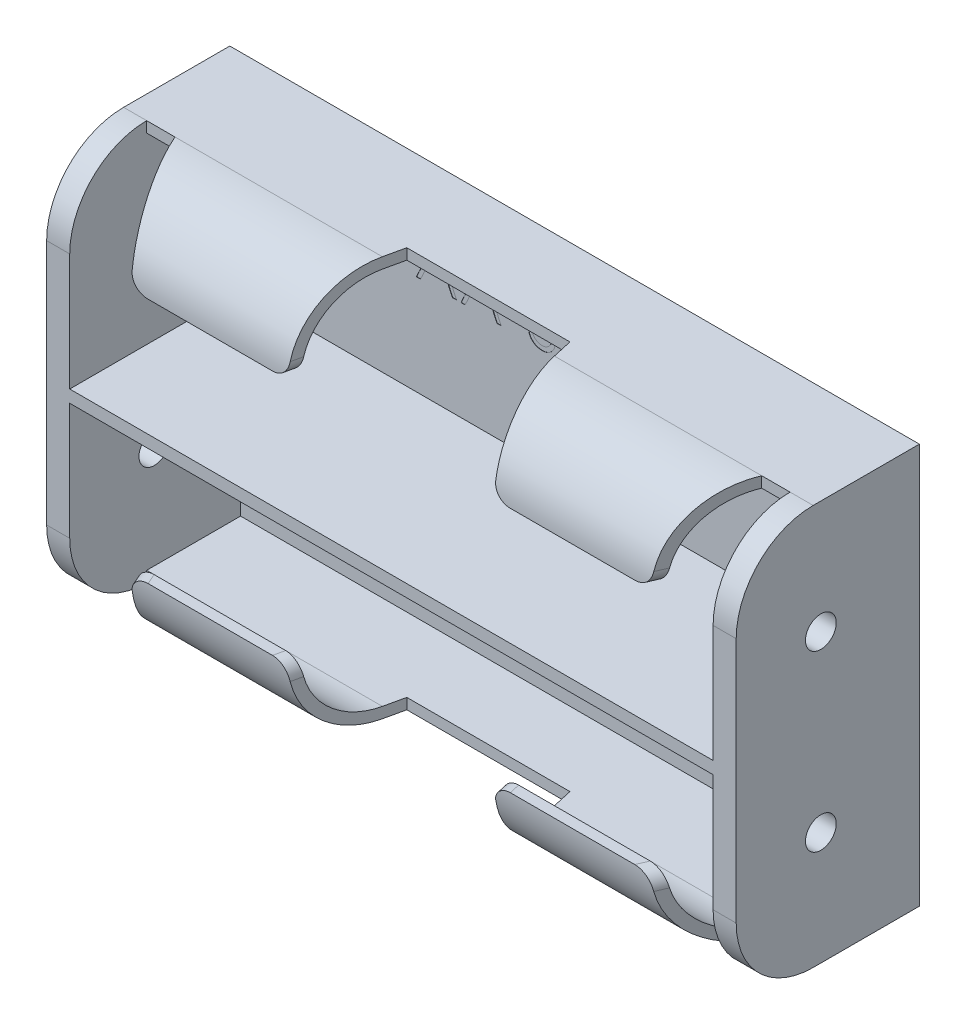
from build123d import *

# Parameters (mm, degrees)
SKETCH1_W            = 56.896
SKETCH1_H            = 33.02
EXTRUDE1_DEPTH       = 15.113
FILLET1_R            = 6.35
CUT_EXTRUDE1_DEPTH   = 26.543
CUT_EXTRUDE2_DEPTH   = 7.112
FILLET2_R            = 1.27
SKETCH4_R            = 1.27
CUT_EXTRUDE3_DEPTH   = 49.403
FILLET2_OF_MIRROR1_R = 1.27
SKETCH5_W            = 1.346153846
SKETCH5_H            = 0.358974359
CUT_EXTRUDE4_DEPTH   = 0.0254


with BuildPart() as part:
    # Sketch1 → Extrude1 (new body)
    with BuildSketch(Plane.XY):
        Rectangle(SKETCH1_W, SKETCH1_H)
    extrude(amount=EXTRUDE1_DEPTH)

    # Fillet1
    fillet1_edges = [part.edges().sort_by_distance(p)[0] for p in [
        (0, 16.51, 15.113),
        (0, -16.51, 15.113),
    ]]
    fillet(fillet1_edges, radius=FILLET1_R)

    # Sketch2 → Cut-Extrude1 (cut, symmetric)
    with BuildSketch(Plane(origin=(0, 0, 0), x_dir=(0, 0, -1), z_dir=(1, 0, 0))):
        with BuildLine():
            Line((-1.016, 15.621), (-1.016, 0.508))
            Line((-1.016, 0.508), (-15.113, 0.508))
            Line((-15.113, 0.508), (-15.113, 10.16))
            Line((-15.113, 10.16), (-14.224, 10.16))
            ThreePointArc((-14.224, 10.16), (-12.624510132, 14.021510132), (-8.763, 15.621))
            Line((-8.763, 15.621), (-1.016, 15.621))
        make_face()
    cut_extrude1 = extrude(amount=CUT_EXTRUDE1_DEPTH, both=True, mode=Mode.SUBTRACT)

    # Sketch3 → Cut-Extrude2 (cut)
    with BuildSketch(Plane(origin=(0, 16.51, 0), x_dir=(-1, 0, 0), z_dir=(0, 1, 0))):
        Polygon((-8.509, 15.113), (8.509, 15.113), (6.731, 7.112), (-6.731, 7.112), align=None)
        Polygon((-26.543, 8.763), (-26.543, 15.113), (-21.463, 15.113), (-24.2062, 8.763), align=None)
        Polygon((26.543, 8.763), (24.2062, 8.763), (21.463, 15.113), (26.543, 15.113), align=None)
    cut_extrude2 = extrude(amount=-CUT_EXTRUDE2_DEPTH, mode=Mode.SUBTRACT)

    # Fillet2
    fillet2_edges = [part.edges().sort_by_distance(p)[0] for p in [
        (-21.655024, 10.16, 14.6685),
        (-8.410222222, 10.16, 14.6685),
        (21.655024, 10.16, 14.6685),
        (8.410222222, 10.16, 14.6685),
    ]]
    fillet(fillet2_edges, radius=FILLET2_R)

    # Sketch4 → Cut-Extrude3 (cut, symmetric)
    with BuildSketch(Plane(origin=(0, 0, 0), x_dir=(0, 0, -1), z_dir=(1, 0, 0))):
        with Locations((-8.128, 7.1755)):
            Circle(SKETCH4_R)
    cut_extrude3 = extrude(amount=CUT_EXTRUDE3_DEPTH, both=True, mode=Mode.SUBTRACT)

    # Mirror1: Cut-Extrude1, Cut-Extrude2, Cut-Extrude3 across plane
    add(cut_extrude1.mirror(Plane.ZX), mode=Mode.SUBTRACT)
    add(cut_extrude2.mirror(Plane.ZX), mode=Mode.SUBTRACT)
    add(cut_extrude3.mirror(Plane.ZX), mode=Mode.SUBTRACT)

    # Fillet2 of Mirror1
    fillet2_of_mirror1_edges = [part.edges().sort_by_distance(p)[0] for p in [
        (-21.655024, -10.16, 14.6685),
        (-8.410222222, -10.16, 14.6685),
        (21.655024, -10.16, 14.6685),
        (8.410222222, -10.16, 14.6685),
    ]]
    fillet(fillet2_of_mirror1_edges, radius=FILLET2_OF_MIRROR1_R)

    # Sketch5 → Cut-Extrude4 (cut)
    # profile 1 of 18: a face of its own
    with BuildSketch(Plane.XY.offset(1.016)):
        with BuildLine():
            Line((-19.042761869, 12.232997554), (-18.342341196, 12.232997554))
            add(Edge.make_bspline(
                [(-18.342341196, 12.232997554), (-18.295600068, 12.232841968), (-18.205851923, 12.232543225), (-18.077278653, 12.230877462), (-17.960451556, 12.226103107), (-17.855431717, 12.221994523), (-17.762221062, 12.214502582), (-17.680533771, 12.207341935), (-17.610746073, 12.197968274), (-17.568500222, 12.189262851), (-17.549372446, 12.185321272)],
                knots=[0, 0, 0, 0, 1.410062039, 2.707475311, 3.878576406, 4.937260626, 5.877586885, 6.699081471, 7.410979367, 8, 8, 8, 8], degree=3))
            add(Edge.make_bspline(
                [(-17.549372446, 12.185321272), (-17.523765822, 12.178994506), (-17.473098833, 12.166475943), (-17.400148766, 12.140016342), (-17.330634443, 12.109396717), (-17.264844618, 12.073432997), (-17.203108827, 12.031858217), (-17.144790516, 11.985390095), (-17.089625053, 11.934282889), (-17.039843423, 11.877248047), (-16.992904371, 11.817411538), (-16.953315744, 11.752707781), (-16.919189265, 11.685046253), (-16.892018748, 11.613738836), (-16.870140774, 11.539477064), (-16.854714535, 11.461588267), (-16.845463347, 11.380427292), (-16.844521492, 11.325069383), (-16.84404392, 11.296999958)],
                knots=[0, 0, 0, 0, 1.027469482, 2.033020251, 3.019912614, 3.986113645, 4.951240523, 5.91722682, 6.890402269, 7.87763091, 8.8651537, 9.85103654, 10.82876324, 11.815024772, 12.821070561, 13.842952187, 14.906261191, 16, 16, 16, 16], degree=3))
            add(Edge.make_bspline(
                [(-16.84404392, 11.296999958), (-16.845512919, 11.250364853), (-16.848379314, 11.159367685), (-16.875104418, 11.027306804), (-16.918880938, 10.904117489), (-16.979204227, 10.789954851), (-17.056023703, 10.687044206), (-17.148348494, 10.59665375), (-17.256230105, 10.521013838), (-17.356659421, 10.468561033), (-17.445373621, 10.434968124), (-17.518406934, 10.411331766), (-17.598073911, 10.3930698), (-17.683611246, 10.376709669), (-17.775374901, 10.364357974), (-17.873144941, 10.35531138), (-17.976991092, 10.349657331), (-18.048330161, 10.348815326), (-18.085029497, 10.348382169)],
                knots=[0, 0, 0, 0, 1.260483769, 2.459530307, 3.627416485, 4.787058657, 5.939039949, 7.08810263, 8.267026773, 9.491475466, 10.141966685, 10.831826277, 11.566392101, 12.351337768, 13.187381173, 14.07005841, 15.007169909, 16, 16, 16, 16], degree=3))
            Line((-18.085029497, 10.348382169), (-16.799172126, 8.732997554))
            Line((-16.799172126, 8.732997554), (-17.1875936, 8.732997554))
            Line((-17.1875936, 8.732997554), (-18.473450972, 10.348382169))
            Line((-18.473450972, 10.348382169), (-18.728659305, 10.348382169))
            Line((-18.728659305, 10.348382169), (-18.728659305, 8.732997554))
            Line((-18.728659305, 8.732997554), (-19.042761869, 8.732997554))
            Line((-19.042761869, 8.732997554), (-19.042761869, 12.232997554))
        make_face()
        with BuildLine():
            Line((-18.728659305, 11.874023195), (-18.728659305, 10.707356528))
            Line((-18.728659305, 10.707356528), (-18.087833985, 10.702448675))
            add(Edge.make_bspline(
                [(-18.087833985, 10.702448675), (-18.057913946, 10.702435439), (-17.999920389, 10.702409782), (-17.916019724, 10.706403559), (-17.837899612, 10.710946877), (-17.76585886, 10.717896222), (-17.699865285, 10.726852294), (-17.639951871, 10.738055278), (-17.586020819, 10.751107341), (-17.523122281, 10.771308967), (-17.45288575, 10.803314985), (-17.37655429, 10.849880484), (-17.311551952, 10.908449603), (-17.25663409, 10.975423059), (-17.212504658, 11.049059308), (-17.181392604, 11.128475677), (-17.161650162, 11.211667275), (-17.159321616, 11.268845383), (-17.158146485, 11.297701079)],
                knots=[0, 0, 0, 0, 1.146690395, 2.22261258, 3.21895312, 4.145990853, 4.996080663, 5.770904154, 6.481378293, 7.121626537, 8.300444488, 9.431385265, 10.535395872, 11.636531494, 12.74115979, 13.810798291, 14.895190096, 16, 16, 16, 16], degree=3))
            add(Edge.make_bspline(
                [(-17.158146485, 11.297701079), (-17.159348606, 11.325847653), (-17.161730771, 11.381623892), (-17.18117954, 11.463279802), (-17.214068921, 11.540346752), (-17.258391159, 11.612511237), (-17.312390314, 11.678016973), (-17.375708126, 11.734064126), (-17.446613322, 11.780313591), (-17.51288452, 11.809867971), (-17.572118732, 11.827987824), (-17.623548393, 11.840738988), (-17.68165987, 11.850983457), (-17.746735329, 11.859191518), (-17.81849696, 11.866246462), (-17.897307611, 11.870998241), (-17.982644391, 11.873812105), (-18.041791322, 11.873951194), (-18.072409305, 11.874023195)],
                knots=[0, 0, 0, 0, 1.101028733, 2.181837193, 3.264309656, 4.369019818, 5.486613113, 6.575447106, 7.666700264, 8.788928104, 9.402425223, 10.0903467, 10.862060571, 11.710948788, 12.657782767, 13.684531032, 14.801375019, 16, 16, 16, 16], degree=3))
            Line((-18.072409305, 11.874023195), (-18.728659305, 11.874023195))
        make_face(mode=Mode.SUBTRACT)
    # profile 2 of 18: a face of its own
    with BuildSketch(Plane.XY.offset(1.016)):
        with BuildLine():
            Line((-14.779941356, 12.322741143), (-14.538054337, 12.132737137))
            Line((-14.538054337, 12.132737137), (-15.462833985, 10.718574477))
            add(Edge.make_bspline(
                [(-15.462833985, 10.718574477), (-15.401263708, 10.728388337), (-15.281163921, 10.747531382), (-15.159598022, 10.750689328), (-15.100354017, 10.752228323)],
                knots=[0, 0, 0, 0, 1.025318673, 2, 2, 2, 2], degree=3))
            add(Edge.make_bspline(
                [(-15.100354017, 10.752228323), (-15.06478152, 10.751272211), (-14.99475812, 10.749390134), (-14.891951318, 10.734906283), (-14.793162382, 10.712081171), (-14.698800769, 10.678808915), (-14.608527788, 10.636306561), (-14.521825391, 10.585367691), (-14.440323381, 10.52336201), (-14.362972202, 10.454097054), (-14.292745105, 10.37738007), (-14.230569049, 10.295978733), (-14.178342257, 10.209977852), (-14.135968336, 10.119420986), (-14.103063457, 10.024447727), (-14.079075812, 9.925179587), (-14.064896219, 9.821548116), (-14.062970729, 9.751069941), (-14.061992638, 9.715269188)],
                knots=[0, 0, 0, 0, 1.04369286, 2.054478336, 3.041073146, 4.015093852, 4.984733326, 5.965804835, 6.960378782, 7.985147595, 9.009457201, 10.008161701, 10.986880575, 11.956520048, 12.937015923, 13.931873656, 14.949455224, 16, 16, 16, 16], degree=3))
            add(Edge.make_bspline(
                [(-14.061992638, 9.715269188), (-14.063415743, 9.666289484), (-14.066216077, 9.569909018), (-14.094119873, 9.429532312), (-14.137479518, 9.295799796), (-14.199457046, 9.170846625), (-14.276439429, 9.054844055), (-14.370317022, 8.95205859), (-14.47776051, 8.860388553), (-14.599247308, 8.783731934), (-14.729990272, 8.721128883), (-14.86734227, 8.67616364), (-15.009969416, 8.648480171), (-15.106774024, 8.645009568), (-15.155742638, 8.643253964)],
                knots=[0, 0, 0, 0, 1.031375318, 2.029502543, 3.004789286, 3.987476834, 4.960371455, 5.9300674, 6.912260825, 7.929083631, 8.949397511, 9.960523116, 10.96833055, 12, 12, 12, 12], degree=3))
            add(Edge.make_bspline(
                [(-15.155742638, 8.643253964), (-15.202839339, 8.64478217), (-15.296129657, 8.647809278), (-15.433362451, 8.674775216), (-15.565225469, 8.718482318), (-15.69079485, 8.778696597), (-15.807115462, 8.85475448), (-15.911181099, 8.946316759), (-16.002472873, 9.051426224), (-16.078447494, 9.170066571), (-16.138706226, 9.297556529), (-16.183896151, 9.430493685), (-16.210292395, 9.568393667), (-16.213980952, 9.661874806), (-16.215838792, 9.708959092)],
                knots=[0, 0, 0, 0, 1.012016664, 2.004627821, 2.994792927, 3.992885782, 4.990978636, 5.973936114, 6.964471063, 7.975201453, 8.993600317, 9.990122807, 10.98767138, 12, 12, 12, 12], degree=3))
            add(Edge.make_bspline(
                [(-16.215838792, 9.708959092), (-16.214657347, 9.745003675), (-16.212245062, 9.818599827), (-16.195401672, 9.930063855), (-16.168336877, 10.044114937), (-16.138026631, 10.140869131), (-16.106001021, 10.220130653), (-16.079348481, 10.284034143), (-16.046174485, 10.349795216), (-16.010801104, 10.419668852), (-15.970044235, 10.491854285), (-15.925728586, 10.567557955), (-15.876628935, 10.645575882), (-15.842208772, 10.698520077), (-15.824612831, 10.725585695)],
                knots=[0, 0, 0, 0, 1.173818275, 2.396712641, 3.66331629, 4.989737886, 5.693666774, 6.447286557, 7.243889047, 8.091586357, 8.998013824, 9.943181721, 10.948533338, 12, 12, 12, 12], degree=3))
            Line((-15.824612831, 10.725585695), (-14.779941356, 12.322741143))
        make_face()
        with BuildLine():
            add(Edge.make_bspline(
                [(-15.166259465, 10.393253964), (-15.19292171, 10.39247592), (-15.24500082, 10.390956175), (-15.321408234, 10.382130923), (-15.393721486, 10.365511857), (-15.462898619, 10.344345525), (-15.527646322, 10.315242466), (-15.588435162, 10.279890667), (-15.645500214, 10.238269489), (-15.698243766, 10.190968578), (-15.746063429, 10.139180545), (-15.78724456, 10.083711022), (-15.82276696, 10.025896819), (-15.851648779, 9.965254877), (-15.874138855, 9.901808377), (-15.890407106, 9.835849128), (-15.899460857, 9.766934822), (-15.900967088, 9.720202319), (-15.901736228, 9.6963389)],
                knots=[0, 0, 0, 0, 1.129588631, 2.206414736, 3.251139165, 4.268635594, 5.265702196, 6.250456724, 7.242448911, 8.251968645, 9.246821453, 10.222880186, 11.173611482, 12.116736599, 13.062300278, 14.020270554, 14.989073742, 16, 16, 16, 16], degree=3))
            add(Edge.make_bspline(
                [(-15.901736228, 9.6963389), (-15.901109867, 9.67268892), (-15.899881665, 9.62631483), (-15.888729345, 9.557975651), (-15.871694263, 9.492210742), (-15.846353867, 9.429359143), (-15.816126979, 9.368462825), (-15.776221655, 9.31172754), (-15.732004869, 9.25570747), (-15.679150935, 9.204705998), (-15.622427572, 9.157249374), (-15.56182637, 9.115769121), (-15.49866641, 9.080282947), (-15.432094988, 9.05247185), (-15.363056604, 9.029647563), (-15.29097605, 9.013586084), (-15.215803194, 9.004505558), (-15.164881256, 9.002997364), (-15.138915715, 9.002228323)],
                knots=[0, 0, 0, 0, 0.989467248, 1.94019797, 2.891935182, 3.827694429, 4.772920941, 5.730924762, 6.725747692, 7.756678648, 8.79901574, 9.819492441, 10.826891316, 11.826466727, 12.835195252, 13.867842842, 14.912794438, 16, 16, 16, 16], degree=3))
            add(Edge.make_bspline(
                [(-15.138915715, 9.002228323), (-15.112950217, 9.002997424), (-15.062028362, 9.004505736), (-14.986854902, 9.013585405), (-14.914776583, 9.029650053), (-14.845730075, 9.052462823), (-14.779188644, 9.080316433), (-14.716083922, 9.115548353), (-14.656055829, 9.15750447), (-14.599295229, 9.204624898), (-14.546661291, 9.25599775), (-14.501384012, 9.311227473), (-14.462700779, 9.368921368), (-14.431266592, 9.429119258), (-14.4062053, 9.492248746), (-14.389083833, 9.55796547), (-14.377954544, 9.626317496), (-14.376723178, 9.67268982), (-14.376095203, 9.6963389)],
                knots=[0, 0, 0, 0, 1.087397944, 2.132534446, 3.165364764, 4.174271784, 5.174024072, 6.181601208, 7.194203697, 8.236725232, 9.267838612, 10.269026844, 11.221737037, 12.171628256, 13.107553087, 14.05945871, 15.010357665, 16, 16, 16, 16], degree=3))
            add(Edge.make_bspline(
                [(-14.376095203, 9.6963389), (-14.376645496, 9.720233451), (-14.377725542, 9.767130683), (-14.38994149, 9.835818301), (-14.406883864, 9.902143508), (-14.432466895, 9.965689457), (-14.46570344, 10.026205384), (-14.506186847, 10.083996985), (-14.553019417, 10.139507332), (-14.607116957, 10.191070141), (-14.66600719, 10.238217219), (-14.728622776, 10.279836775), (-14.79413075, 10.314961752), (-14.862464692, 10.344268854), (-14.934407575, 10.365418328), (-15.008797914, 10.382071571), (-15.086587156, 10.390933589), (-15.139363765, 10.392470654), (-15.166259465, 10.393253964)],
                knots=[0, 0, 0, 0, 0.978206639, 1.919901502, 2.851605144, 3.780102724, 4.718870031, 5.675451981, 6.667674623, 7.690630536, 8.733308323, 9.756129687, 10.767539656, 11.776269907, 12.797430371, 13.836405707, 14.897401972, 16, 16, 16, 16], degree=3))
        make_face(mode=Mode.SUBTRACT)
    # profile 3 of 18: a face of its own
    with BuildSketch(Plane.XY.offset(1.016)):
        with Locations((-13.029941356, 10.0791514)):
            Rectangle(SKETCH5_W, SKETCH5_H)
    # profile 4 of 18: a face of its own
    with BuildSketch(Plane.XY.offset(1.016)):
        Polygon((-10.337633664, 12.232997554), (-8.722249049, 8.732997554), (-9.063695363, 8.732997554), (-9.581123247, 9.854792425), (-11.167761869, 9.854792425), (-11.699913312, 8.732997554), (-12.042761869, 8.732997554), (-10.382505459, 12.232997554), align=None)
        Polygon((-10.36357517, 11.550806047), (-10.997389273, 10.213766784), (-9.746587991, 10.213766784), align=None, mode=Mode.SUBTRACT)
    # profile 5 of 18: a face of its own
    with BuildSketch(Plane.XY.offset(1.016)):
        Polygon((-6.658146485, 12.232997554), (-5.042761869, 8.732997554), (-5.384208183, 8.732997554), (-5.901636068, 9.854792425), (-7.48827469, 9.854792425), (-8.020426132, 8.732997554), (-8.36327469, 8.732997554), (-6.703018279, 12.232997554), align=None)
        Polygon((-6.684087991, 11.550806047), (-7.317902094, 10.213766784), (-6.067100812, 10.213766784), align=None, mode=Mode.SUBTRACT)
    # profile 6 of 18: a face of its own
    with BuildSketch(Plane.XY.offset(1.016)):
        with Locations((-4.055582382, 10.0791514)):
            Rectangle(SKETCH5_W, SKETCH5_H)
    # profile 7 of 18: a face of its own
    with BuildSketch(Plane.XY.offset(1.016)):
        with BuildLine():
            Line((-2.799172126, 12.232997554), (-2.485069562, 12.232997554))
            Line((-2.485069562, 12.232997554), (-2.485069562, 10.135942265))
            add(Edge.make_bspline(
                [(-2.485069562, 10.135942265), (-2.485116305, 10.106261529), (-2.48520501, 10.049937219), (-2.484612496, 9.969768918), (-2.482953128, 9.898496459), (-2.481906968, 9.835845111), (-2.479579635, 9.782102364), (-2.477681588, 9.736977053), (-2.475241031, 9.700682851), (-2.472307914, 9.679501925), (-2.471047126, 9.670397393)],
                knots=[0, 0, 0, 0, 1.528628734, 2.90083645, 4.128790002, 5.200304208, 6.127813768, 6.898992206, 7.526736466, 8, 8, 8, 8], degree=3))
            add(Edge.make_bspline(
                [(-2.471047126, 9.670397393), (-2.465869667, 9.63755063), (-2.45580648, 9.573707901), (-2.430160103, 9.482799619), (-2.394342602, 9.400868161), (-2.351899559, 9.32535687), (-2.295966948, 9.25836751), (-2.228963412, 9.196655857), (-2.147785644, 9.142684052), (-2.057525038, 9.09333324), (-1.960239801, 9.053668158), (-1.860828534, 9.023674794), (-1.760785555, 9.005395894), (-1.69380939, 9.003279355), (-1.660550331, 9.002228323)],
                knots=[0, 0, 0, 0, 1.035780045, 2.013197591, 2.933192213, 3.817615948, 4.702609284, 5.640816605, 6.646850145, 7.73207398, 8.84249596, 9.914020372, 10.964143139, 12, 12, 12, 12], degree=3))
            add(Edge.make_bspline(
                [(-1.660550331, 9.002228323), (-1.63199659, 9.003302173), (-1.575054028, 9.005443671), (-1.490447598, 9.018705102), (-1.408047489, 9.042605668), (-1.327446809, 9.073445427), (-1.251895825, 9.114193018), (-1.181352383, 9.161263857), (-1.118388449, 9.216474733), (-1.060930451, 9.277575078), (-1.010895515, 9.346514878), (-0.967524373, 9.421793016), (-0.931998444, 9.504542363), (-0.914454919, 9.562696785), (-0.905442158, 9.592572874)],
                knots=[0, 0, 0, 0, 0.994687771, 1.983630487, 2.973142513, 3.978332533, 4.983357753, 5.956394766, 6.925816176, 7.893390482, 8.871859704, 9.88551698, 10.913711441, 12, 12, 12, 12], degree=3))
            add(Edge.make_bspline(
                [(-0.905442158, 9.592572874), (-0.902442032, 9.604921449), (-0.895756544, 9.632439049), (-0.889509499, 9.678960339), (-0.883002974, 9.733849703), (-0.878488404, 9.797501516), (-0.874087183, 9.869702489), (-0.871454111, 9.950828746), (-0.870237078, 10.040585707), (-0.869874397, 10.103222869), (-0.869684946, 10.135942265)],
                knots=[0, 0, 0, 0, 0.558680831, 1.244966039, 2.062412453, 2.990489873, 4.051219941, 5.244515665, 6.560634259, 8, 8, 8, 8], degree=3))
            Line((-0.869684946, 10.135942265), (-0.869684946, 12.232997554))
            Line((-0.869684946, 12.232997554), (-0.555582382, 12.232997554))
            Line((-0.555582382, 12.232997554), (-0.555582382, 10.119115342))
            add(Edge.make_bspline(
                [(-0.555582382, 10.119115342), (-0.555836502, 10.081016963), (-0.556332434, 10.00666566), (-0.56063301, 9.897714301), (-0.56749001, 9.79436132), (-0.577178098, 9.696592823), (-0.590015101, 9.604758664), (-0.604290322, 9.518053896), (-0.622469855, 9.437100903), (-0.643703256, 9.361268486), (-0.667976804, 9.289082972), (-0.699417952, 9.220574358), (-0.734842452, 9.153659958), (-0.776857105, 9.089351849), (-0.824068488, 9.027365296), (-0.877520169, 8.968076221), (-0.93544433, 8.910537175), (-0.998803889, 8.856224109), (-1.066554414, 8.806415432), (-1.138494372, 8.762617661), (-1.214071142, 8.725594043), (-1.293088268, 8.695118119), (-1.375579471, 8.672203519), (-1.461546831, 8.655128364), (-1.551186024, 8.645426066), (-1.61215068, 8.643984136), (-1.643022286, 8.643253964)],
                knots=[0, 0, 0, 0, 1.316592851, 2.569410997, 3.76748051, 4.895814652, 5.963796859, 6.97159953, 7.931736103, 8.829262218, 9.692595152, 10.560224239, 11.431080259, 12.30701507, 13.211635791, 14.121146779, 15.063487852, 16.031507147, 17.00238618, 17.966455255, 18.938106653, 19.907068911, 20.888905087, 21.893141452, 22.933117798, 24, 24, 24, 24], degree=3))
            add(Edge.make_bspline(
                [(-1.643022286, 8.643253964), (-1.676691388, 8.644038729), (-1.742750047, 8.645578436), (-1.840088115, 8.654401186), (-1.933402311, 8.67101958), (-2.023678188, 8.692179524), (-2.109686685, 8.721363261), (-2.192580129, 8.755461386), (-2.270938811, 8.797338646), (-2.346033939, 8.843932039), (-2.415858695, 8.896356678), (-2.479956098, 8.953496852), (-2.538431969, 9.014437229), (-2.590300665, 9.079837595), (-2.63642155, 9.149189302), (-2.676151763, 9.222688542), (-2.710265008, 9.300306858), (-2.727871575, 9.354260058), (-2.736772286, 9.381535214)],
                knots=[0, 0, 0, 0, 1.13879206, 2.234305948, 3.301075583, 4.341971843, 5.366689343, 6.369221514, 7.369726634, 8.367512178, 9.355451585, 10.318319045, 11.268648973, 12.207971039, 13.137398894, 14.081662264, 15.030215811, 16, 16, 16, 16], degree=3))
            add(Edge.make_bspline(
                [(-2.736772286, 9.381535214), (-2.741949444, 9.400167788), (-2.753178815, 9.440582257), (-2.765204113, 9.507468746), (-2.775313195, 9.584483664), (-2.784818753, 9.671632282), (-2.790427711, 9.768982148), (-2.79534515, 9.876491064), (-2.799206768, 9.994289026), (-2.799183996, 10.076343542), (-2.799172126, 10.119115342)],
                knots=[0, 0, 0, 0, 0.625038921, 1.35572334, 2.194682327, 3.136881307, 4.189498639, 5.346923369, 6.617055217, 8, 8, 8, 8], degree=3))
            Line((-2.799172126, 10.119115342), (-2.799172126, 12.232997554))
        make_face()
    # profile 8 of 18: a face of its own
    with BuildSketch(Plane.XY.offset(1.016)):
        Polygon((0.162366336, 8.732997554), (0.624405599, 12.232997554), (0.669277394, 12.232997554), (2.114289413, 9.361202682), (3.555795823, 12.232997554), (3.60136874, 12.232997554), (4.06621249, 8.732997554), (3.750707682, 8.732997554), (3.415571464, 11.251427041), (2.15214999, 8.732997554), (2.081336688, 8.732997554), (0.813007362, 11.257036015), (0.478572265, 8.732997554), align=None)
    # profile 9 of 18: a face of its own
    with BuildSketch(Plane.XY.offset(1.016)):
        with BuildLine():
            Line((4.918776592, 11.425305246), (4.604674028, 11.425305246))
            add(Edge.make_bspline(
                [(4.604674028, 11.425305246), (4.613183579, 11.46053773), (4.629819054, 11.529414354), (4.664516628, 11.627821615), (4.702315883, 11.720945137), (4.747704988, 11.80704121), (4.797213742, 11.887840113), (4.853936463, 11.961509237), (4.915256186, 12.029922203), (4.983081135, 12.09063544), (5.054209797, 12.14561317), (5.129644417, 12.192488227), (5.20786731, 12.23281238), (5.289420443, 12.266032612), (5.374546615, 12.291058135), (5.462476238, 12.309214941), (5.553439738, 12.321006055), (5.615187329, 12.322156818), (5.646541015, 12.322741143)],
                knots=[0, 0, 0, 0, 1.162005537, 2.271625781, 3.343758855, 4.383309926, 5.390229558, 6.379919256, 7.361854164, 8.333198761, 9.295911338, 10.242430842, 11.177959212, 12.116337295, 13.062827104, 14.020064771, 14.994644689, 16, 16, 16, 16], degree=3))
            add(Edge.make_bspline(
                [(5.646541015, 12.322741143), (5.692223757, 12.321361913), (5.782592768, 12.318633538), (5.915355815, 12.293719101), (6.043382634, 12.254293969), (6.165271882, 12.199820242), (6.278490315, 12.132632929), (6.379226502, 12.052668192), (6.466115012, 11.96146889), (6.53900939, 11.860736326), (6.596084389, 11.753080816), (6.638170763, 11.642280659), (6.663792444, 11.528598688), (6.667113, 11.451841409), (6.668776592, 11.413386175)],
                knots=[0, 0, 0, 0, 1.083050992, 2.142477498, 3.193116406, 4.255571735, 5.30263384, 6.308962982, 7.297363603, 8.282367274, 9.249857812, 10.179914175, 11.08814088, 12, 12, 12, 12], degree=3))
            add(Edge.make_bspline(
                [(6.668776592, 11.413386175), (6.667613001, 11.376379381), (6.665336034, 11.303962826), (6.646002329, 11.198241329), (6.613466066, 11.098599729), (6.568396303, 11.004618567), (6.510054753, 10.916893727), (6.439382056, 10.835227836), (6.355879394, 10.759258678), (6.292600456, 10.715739205), (6.260022586, 10.693334092)],
                knots=[0, 0, 0, 0, 1.024540389, 2.004866551, 2.965041327, 3.920577974, 4.882998113, 5.874504559, 6.905732034, 8, 8, 8, 8], degree=3))
            add(Edge.make_bspline(
                [(6.260022586, 10.693334092), (6.297254341, 10.675355921), (6.371021215, 10.639735963), (6.471571744, 10.569880205), (6.56284962, 10.489223858), (6.613753339, 10.426281205), (6.639329477, 10.394656208)],
                knots=[0, 0, 0, 0, 1.015518401, 2.012035669, 3.001164323, 4, 4, 4, 4], degree=3))
            add(Edge.make_bspline(
                [(6.639329477, 10.394656208), (6.656170819, 10.371598456), (6.689577715, 10.325860539), (6.730813249, 10.252324113), (6.768222363, 10.177972624), (6.797372583, 10.100813218), (6.81994645, 10.021740204), (6.836082482, 9.940617808), (6.846106623, 9.857379786), (6.847542175, 9.801067306), (6.848263772, 9.772761175)],
                knots=[0, 0, 0, 0, 1.025084078, 2.033381695, 3.024893161, 4.013698104, 4.991890475, 5.976764909, 6.982997093, 8, 8, 8, 8], degree=3))
            add(Edge.make_bspline(
                [(6.848263772, 9.772761175), (6.846469258, 9.723751454), (6.842888676, 9.625962652), (6.810884602, 9.481487931), (6.761271361, 9.340262429), (6.690814425, 9.205187589), (6.604946916, 9.078807208), (6.502789592, 8.965730899), (6.385503184, 8.868532295), (6.254697535, 8.787322067), (6.112980407, 8.722404145), (5.961404815, 8.677346702), (5.802154761, 8.648000702), (5.692947463, 8.644853833), (5.637426432, 8.643253964)],
                knots=[0, 0, 0, 0, 0.955779014, 1.907060117, 2.875433937, 3.871313158, 4.872415639, 5.851225146, 6.836215519, 7.83643374, 8.849228613, 9.86973379, 10.916971861, 12, 12, 12, 12], degree=3))
            add(Edge.make_bspline(
                [(5.637426432, 8.643253964), (5.600007132, 8.644122177), (5.526378427, 8.645830531), (5.418134928, 8.657509133), (5.314813229, 8.678839138), (5.216273631, 8.707542443), (5.122428595, 8.743934185), (5.03356449, 8.789252883), (4.949134596, 8.842564385), (4.869935645, 8.904497973), (4.795977077, 8.973779313), (4.729224353, 9.051638323), (4.66856456, 9.136635727), (4.615621921, 9.229758783), (4.567984969, 9.32980404), (4.528804012, 9.438052539), (4.494318443, 9.553536561), (4.478284979, 9.634014301), (4.470058644, 9.675305246)],
                knots=[0, 0, 0, 0, 1.048658725, 2.063410685, 3.046034179, 4.001477787, 4.936774919, 5.862367409, 6.792675028, 7.730719943, 8.675894397, 9.627829632, 10.600096036, 11.597688215, 12.626045268, 13.701542398, 14.82072376, 16, 16, 16, 16], degree=3))
            Line((4.470058644, 9.675305246), (4.784161208, 9.675305246))
            add(Edge.make_bspline(
                [(4.784161208, 9.675305246), (4.792344499, 9.648356233), (4.808261712, 9.595938061), (4.83535601, 9.520497755), (4.866224282, 9.451339702), (4.899338841, 9.38795658), (4.934117287, 9.329724178), (4.973032212, 9.278182309), (5.013201357, 9.231067106), (5.04348071, 9.204522495), (5.05829983, 9.191531208)],
                knots=[0, 0, 0, 0, 1.198163088, 2.33053128, 3.407730985, 4.417276592, 5.372219308, 6.28897303, 7.162600585, 8, 8, 8, 8], degree=3))
            add(Edge.make_bspline(
                [(5.05829983, 9.191531208), (5.077896406, 9.176422874), (5.117029069, 9.146252842), (5.1807973, 9.107751213), (5.247862186, 9.074390188), (5.31967686, 9.048906492), (5.394691631, 9.027328831), (5.474118996, 9.013208312), (5.557258213, 9.003520141), (5.614025977, 9.002665209), (5.643035406, 9.002228323)],
                knots=[0, 0, 0, 0, 0.946170439, 1.889420265, 2.845303464, 3.807233317, 4.801018734, 5.828864929, 6.890507805, 8, 8, 8, 8], degree=3))
            add(Edge.make_bspline(
                [(5.643035406, 9.002228323), (5.675788909, 9.002844228), (5.739835556, 9.004048578), (5.833290415, 9.015124285), (5.922197863, 9.031254698), (6.005570789, 9.056167681), (6.084501296, 9.086948532), (6.157882946, 9.125596938), (6.226679052, 9.170941659), (6.290008457, 9.222480818), (6.346953965, 9.278902313), (6.397093478, 9.337915384), (6.43971814, 9.399271214), (6.474101718, 9.463309335), (6.501252268, 9.529764563), (6.519735469, 9.598823393), (6.532586984, 9.669920659), (6.533633596, 9.718249628), (6.534161208, 9.742612938)],
                knots=[0, 0, 0, 0, 1.217147791, 2.380027433, 3.494444702, 4.572153297, 5.609568379, 6.639424714, 7.649109417, 8.668170816, 9.669597737, 10.625200337, 11.543417969, 12.441394052, 13.322311151, 14.205496177, 15.095365482, 16, 16, 16, 16], degree=3))
            add(Edge.make_bspline(
                [(6.534161208, 9.742612938), (6.532630906, 9.775224277), (6.529577918, 9.840284685), (6.506269338, 9.93600226), (6.467930474, 10.028225672), (6.414257963, 10.115381462), (6.348922234, 10.196157364), (6.272557327, 10.268228846), (6.184529099, 10.327698937), (6.10350923, 10.368787594), (6.031744073, 10.396824669), (5.970328689, 10.415499633), (5.901572086, 10.431313289), (5.826305737, 10.44602556), (5.74396252, 10.458546909), (5.654632082, 10.468988724), (5.558296321, 10.477343765), (5.491605155, 10.481074861), (5.457238131, 10.482997554)],
                knots=[0, 0, 0, 0, 1.07054697, 2.135767047, 3.216561865, 4.33974944, 5.486079747, 6.621378074, 7.775625952, 8.963672916, 9.598146892, 10.304877434, 11.070270905, 11.915000392, 12.823868403, 13.805723172, 14.86925407, 16, 16, 16, 16], degree=3))
            Line((5.457238131, 10.482997554), (5.457238131, 10.841971913))
            add(Edge.make_bspline(
                [(5.457238131, 10.841971913), (5.500539297, 10.842706716), (5.585355643, 10.844146016), (5.709249948, 10.861554027), (5.82772326, 10.885634655), (5.938150002, 10.922519847), (6.038798715, 10.965360144), (6.126118317, 11.015212353), (6.198885465, 11.070627103), (6.256746536, 11.132459712), (6.300275765, 11.19877476), (6.332102562, 11.267891417), (6.350902888, 11.340415478), (6.353412555, 11.389910146), (6.354674028, 11.414788419)],
                knots=[0, 0, 0, 0, 1.321986639, 2.589447074, 3.816329219, 5.01088745, 6.139805852, 7.153945165, 8.075214402, 8.924034688, 9.728124013, 10.488707548, 11.240355623, 12, 12, 12, 12], degree=3))
            add(Edge.make_bspline(
                [(6.354674028, 11.414788419), (6.354259617, 11.433066164), (6.353435166, 11.469428871), (6.343037889, 11.52255394), (6.327413848, 11.574054886), (6.305934118, 11.623712696), (6.27718392, 11.67118297), (6.242777933, 11.716870419), (6.201809833, 11.760514198), (6.154864386, 11.801194518), (6.104452581, 11.839963755), (6.049202806, 11.872877392), (5.990780931, 11.901022454), (5.929122276, 11.924231956), (5.864026746, 11.941691244), (5.795800188, 11.954227085), (5.724312505, 11.96206474), (5.675540773, 11.963193156), (5.650747746, 11.963766784)],
                knots=[0, 0, 0, 0, 0.884392785, 1.759457502, 2.611959086, 3.489218968, 4.37281399, 5.2945488, 6.255912374, 7.266815255, 8.301784654, 9.332968512, 10.37626691, 11.440494194, 12.520033166, 13.637162961, 14.798855837, 16, 16, 16, 16], degree=3))
            add(Edge.make_bspline(
                [(5.650747746, 11.963766784), (5.610896078, 11.962375422), (5.533056502, 11.959657769), (5.420841585, 11.935854755), (5.316522251, 11.897876672), (5.236783584, 11.852543652), (5.17790101, 11.807793219), (5.135824072, 11.768710832), (5.094503562, 11.725278009), (5.056657885, 11.674819633), (5.018383908, 11.620752843), (4.983539346, 11.560329162), (4.949679654, 11.495124767), (4.929277105, 11.449029133), (4.918776592, 11.425305246)],
                knots=[0, 0, 0, 0, 1.472543308, 2.876219568, 4.221790263, 5.565193594, 6.249813518, 6.953379497, 7.687249741, 8.463570142, 9.283606569, 10.136032583, 11.040678096, 12, 12, 12, 12], degree=3))
        make_face()
    # profile 10 of 18: a face of its own
    with BuildSketch(Plane.XY.offset(1.016)):
        with Locations((7.835443259, 10.0791514)):
            Rectangle(SKETCH5_W, SKETCH5_H)
    # profile 11 of 18: a face of its own
    with BuildSketch(Plane.XY.offset(1.016)):
        Polygon((9.521641176, 12.232997554), (10.168776592, 12.232997554), (10.168776592, 8.732997554), (9.854674028, 8.732997554), (9.854674028, 11.874023195), (9.31621249, 11.874023195), align=None)
    # profile 12 of 18: a face of its own
    with BuildSketch(Plane.XY.offset(1.016)):
        with BuildLine():
            add(Edge.make_bspline(
                [(12.03095608, 9.271459092), (12.050446292, 9.270300925), (12.088654574, 9.268030475), (12.143893702, 9.252453801), (12.193888362, 9.224795141), (12.238420607, 9.187932362), (12.275127083, 9.143236699), (12.303771436, 9.093640791), (12.319212421, 9.037939198), (12.321466333, 8.999509523), (12.322622746, 8.979792425)],
                knots=[0, 0, 0, 0, 1.020151414, 1.999887582, 2.974338812, 3.990962822, 5.007586832, 5.987933904, 6.967670073, 8, 8, 8, 8], degree=3))
            add(Edge.make_bspline(
                [(12.322622746, 8.979792425), (12.321427145, 8.960549096), (12.319069438, 8.922601532), (12.30380683, 8.867320069), (12.27490878, 8.817693165), (12.238673787, 8.772391027), (12.193877353, 8.735450156), (12.143775507, 8.708026811), (12.088784249, 8.691334832), (12.050467926, 8.689208534), (12.03095608, 8.688125759)],
                knots=[0, 0, 0, 0, 1.009421747, 1.99056486, 2.972319754, 3.999869655, 5.017953583, 5.993804169, 6.978383603, 8, 8, 8, 8], degree=3))
            add(Edge.make_bspline(
                [(12.03095608, 8.688125759), (12.011430174, 8.689169356), (11.973310491, 8.691206731), (11.918524497, 8.708369537), (11.868117528, 8.735192998), (11.823329817, 8.772459907), (11.786791345, 8.81746005), (11.759165962, 8.867661847), (11.742575813, 8.922443284), (11.740393941, 8.960517927), (11.739289413, 8.979792425)],
                knots=[0, 0, 0, 0, 1.022052826, 1.995314843, 2.982371812, 4.00089066, 5.028879526, 6.005146991, 6.990147033, 8, 8, 8, 8], degree=3))
            add(Edge.make_bspline(
                [(11.739289413, 8.979792425), (11.740351512, 8.999541805), (11.742425131, 9.038100045), (11.759200791, 9.093299153), (11.786577003, 9.143467592), (11.823582398, 9.187864172), (11.868106694, 9.225051475), (11.918402899, 9.252116268), (11.973442439, 9.26815668), (12.011452377, 9.270339197), (12.03095608, 9.271459092)],
                knots=[0, 0, 0, 0, 1.032775665, 2.016367738, 2.991239715, 4.008302682, 5.025365648, 6.011011707, 6.979408107, 8, 8, 8, 8], degree=3))
        make_face()
    # profile 13 of 18: a face of its own
    with BuildSketch(Plane.XY.offset(1.016)):
        with BuildLine():
            Line((14.970058644, 12.232997554), (14.970058644, 11.874023195))
            Line((14.970058644, 11.874023195), (13.779553836, 11.874023195))
            Line((13.779553836, 11.874023195), (13.590952073, 10.953450278))
            add(Edge.make_bspline(
                [(13.590952073, 10.953450278), (13.628007947, 10.96368055), (13.699797843, 10.983500083), (13.805757704, 11.005505854), (13.906349908, 11.018771298), (13.971625278, 11.020582608), (14.003211688, 11.021459092)],
                knots=[0, 0, 0, 0, 1.100273476, 2.13160584, 3.095893838, 4, 4, 4, 4], degree=3))
            add(Edge.make_bspline(
                [(14.003211688, 11.021459092), (14.042295428, 11.020613156), (14.119143826, 11.018949835), (14.231582773, 11.002977986), (14.338915666, 10.977838071), (14.440918036, 10.94271755), (14.537778587, 10.897807816), (14.628606148, 10.841707876), (14.714764061, 10.776174545), (14.794706655, 10.700829533), (14.867230963, 10.617907916), (14.930996953, 10.528750045), (14.985159543, 10.434222383), (15.028720298, 10.333421774), (15.063504632, 10.227462621), (15.086656627, 10.115230038), (15.102073336, 9.997781918), (15.103795722, 9.917477348), (15.104674028, 9.876527201)],
                knots=[0, 0, 0, 0, 1.052922333, 2.070308379, 3.05430497, 4.020497103, 4.973039431, 5.925935799, 6.892292201, 7.88610001, 8.88166317, 9.857072816, 10.836096531, 11.812156883, 12.81219415, 13.836441305, 14.89672472, 16, 16, 16, 16], degree=3))
            add(Edge.make_bspline(
                [(15.104674028, 9.876527201), (15.104008953, 9.848004981), (15.10268779, 9.791345993), (15.095969203, 9.707201792), (15.083033487, 9.624838959), (15.065665763, 9.544246568), (15.043123345, 9.465577195), (15.015834291, 9.388605667), (14.982438263, 9.313811061), (14.945806888, 9.240485666), (14.90456041, 9.170287158), (14.858781903, 9.104638172), (14.810416411, 9.04255389), (14.758375026, 8.984700157), (14.702174031, 8.93145714), (14.642494064, 8.882508858), (14.579811345, 8.837027528), (14.513156103, 8.796859333), (14.44401362, 8.759896376), (14.371385402, 8.729572839), (14.296924702, 8.702462311), (14.219559826, 8.680852783), (14.139466014, 8.663920229), (14.056511238, 8.652419628), (13.971130568, 8.644043191), (13.913255556, 8.643518834), (13.884020983, 8.643253964)],
                knots=[0, 0, 0, 0, 1.056347294, 2.098418968, 3.122841568, 4.141288669, 5.149314143, 6.15115421, 7.162517403, 8.180376062, 9.185164535, 10.17417709, 11.141909838, 12.097768115, 13.052685741, 14.0056014, 14.954263652, 15.917497458, 16.885230207, 17.854509472, 18.828990115, 19.81800267, 20.826176721, 21.857883937, 22.917946725, 24, 24, 24, 24], degree=3))
            add(Edge.make_bspline(
                [(13.884020983, 8.643253964), (13.849146803, 8.643944802), (13.780535972, 8.645303944), (13.680015405, 8.659522429), (13.583300799, 8.679886346), (13.491170698, 8.710522616), (13.402799434, 8.74890991), (13.319376717, 8.797426082), (13.23877094, 8.852405185), (13.164258904, 8.917285538), (13.09510279, 8.98820122), (13.033196281, 9.065158862), (12.978062705, 9.146888304), (12.930584958, 9.233786458), (12.890086936, 9.325624989), (12.858271948, 9.42274799), (12.832593593, 9.524647994), (12.821730173, 9.594801504), (12.81621249, 9.630433451)],
                knots=[0, 0, 0, 0, 1.0467383, 2.05933395, 3.04377827, 4.011590433, 4.970194871, 5.932262533, 6.905835911, 7.896367577, 8.894135286, 9.877477877, 10.858688626, 11.851381753, 12.8477658, 13.868841284, 14.917554742, 16, 16, 16, 16], degree=3))
            Line((12.81621249, 9.630433451), (13.130315054, 9.630433451))
            add(Edge.make_bspline(
                [(13.130315054, 9.630433451), (13.138043611, 9.597056999), (13.152898328, 9.532905604), (13.185504076, 9.442774262), (13.225369952, 9.362455039), (13.2727743, 9.290885455), (13.329324331, 9.228476458), (13.39385376, 9.172859396), (13.466201483, 9.122684267), (13.546594713, 9.0808615), (13.631407792, 9.045192746), (13.720175002, 9.021441051), (13.810479348, 9.004740159), (13.871557718, 9.003068398), (13.90225015, 9.002228323)],
                knots=[0, 0, 0, 0, 1.136247022, 2.183929868, 3.172523383, 4.106158343, 5.02341133, 5.958108904, 6.928429099, 7.938127109, 8.96079061, 9.975095812, 10.982467395, 12, 12, 12, 12], degree=3))
            add(Edge.make_bspline(
                [(13.90225015, 9.002228323), (13.932208594, 9.003049101), (13.991197017, 9.004665219), (14.078008403, 9.017104231), (14.161821278, 9.036261803), (14.241808634, 9.064931658), (14.319370174, 9.099776376), (14.392543944, 9.144491452), (14.463446821, 9.19595147), (14.529874955, 9.2549081), (14.590714404, 9.319877795), (14.644470525, 9.389355188), (14.689247439, 9.463472035), (14.726981548, 9.540945188), (14.755634846, 9.622623745), (14.776075828, 9.70812492), (14.788078887, 9.7976599), (14.789730066, 9.85872921), (14.790571464, 9.889848515)],
                knots=[0, 0, 0, 0, 1.027316725, 2.022795036, 3.002884548, 3.971462791, 4.93288096, 5.914575861, 6.907176829, 7.935150275, 8.956128384, 9.956726525, 10.942570165, 11.921478529, 12.907843606, 13.90538589, 14.932640048, 16, 16, 16, 16], degree=3))
            add(Edge.make_bspline(
                [(14.790571464, 9.889848515), (14.789912985, 9.917924267), (14.788624105, 9.972878556), (14.778093535, 10.053277762), (14.759776562, 10.129350805), (14.734352682, 10.201465039), (14.702073174, 10.269688481), (14.662626862, 10.334091541), (14.615273464, 10.393825374), (14.561181576, 10.448917928), (14.501923535, 10.499762803), (14.436479792, 10.543106889), (14.366219865, 10.579570807), (14.291990266, 10.611038805), (14.212025367, 10.633639551), (14.127908735, 10.650607436), (14.038732027, 10.660422799), (13.977761339, 10.661784687), (13.946420823, 10.662484733)],
                knots=[0, 0, 0, 0, 1.045622112, 2.046656509, 3.013763289, 3.955457236, 4.890082067, 5.820317437, 6.762574623, 7.722996705, 8.69280354, 9.665887285, 10.63943826, 11.638615906, 12.663482002, 13.728887084, 14.832589034, 16, 16, 16, 16], degree=3))
            add(Edge.make_bspline(
                [(13.946420823, 10.662484733), (13.919291894, 10.661904142), (13.863277539, 10.660705369), (13.777354712, 10.651878872), (13.687062989, 10.637639577), (13.592748494, 10.61805333), (13.494127986, 10.592422253), (13.391409585, 10.561707752), (13.284377318, 10.524985754), (13.212259594, 10.49725354), (13.175186849, 10.482997554)],
                knots=[0, 0, 0, 0, 0.817624296, 1.688186739, 2.600797293, 3.572016777, 4.590301741, 5.671205678, 6.80286297, 8, 8, 8, 8], degree=3))
            Line((13.175186849, 10.482997554), (13.534161208, 12.232997554))
            Line((13.534161208, 12.232997554), (14.970058644, 12.232997554))
        make_face()
    # profile 14 of 18: a face of its own
    with BuildSketch(Plane.XY.offset(1.016)):
        Polygon((15.508520182, 12.232997554), (15.845058644, 12.232997554), (17.01172531, 9.474784413), (18.178391977, 12.232997554), (18.514930438, 12.232997554), (17.034161208, 8.732997554), (16.989289413, 8.732997554), align=None)
    # profile 15 of 18: a face of its own
    with BuildSketch(Plane.XY.offset(1.016)):
        with Locations((-24.200275612, -22.26167311)):
            Rectangle(SKETCH5_W, SKETCH5_H)
    # profile 16 of 18: a face of its own
    with BuildSketch(Plane.XY.offset(1.016)):
        Polygon((-24.977401366, 21.364563602), (-24.977401366, 22.396614884), (-24.663298801, 22.396614884), (-24.663298801, 21.364563602), (-23.631247519, 21.364563602), (-23.631247519, 21.050461038), (-24.663298801, 21.050461038), (-24.663298801, 20.018409756), (-24.977401366, 20.018409756), (-24.977401366, 21.050461038), (-26.009452648, 21.050461038), (-26.009452648, 21.364563602), align=None)
    # profile 17 of 18: a face of its own
    with BuildSketch(Plane.XY.offset(1.016)):
        with Locations((-24.444619762, 7.069132316)):
            Rectangle(SKETCH5_W, SKETCH5_H)
    # profile 18 of 18: a face of its own
    with BuildSketch(Plane.XY.offset(1.016)):
        Polygon((-24.014638353, -7.326977924), (-24.014638353, -6.294926642), (-23.700535789, -6.294926642), (-23.700535789, -7.326977924), (-22.668484507, -7.326977924), (-22.668484507, -7.641080488), (-23.700535789, -7.641080488), (-23.700535789, -8.67313177), (-24.014638353, -8.67313177), (-24.014638353, -7.641080488), (-25.046689635, -7.641080488), (-25.046689635, -7.326977924), align=None)
    extrude(amount=-CUT_EXTRUDE4_DEPTH, mode=Mode.SUBTRACT)


solid = part.part
